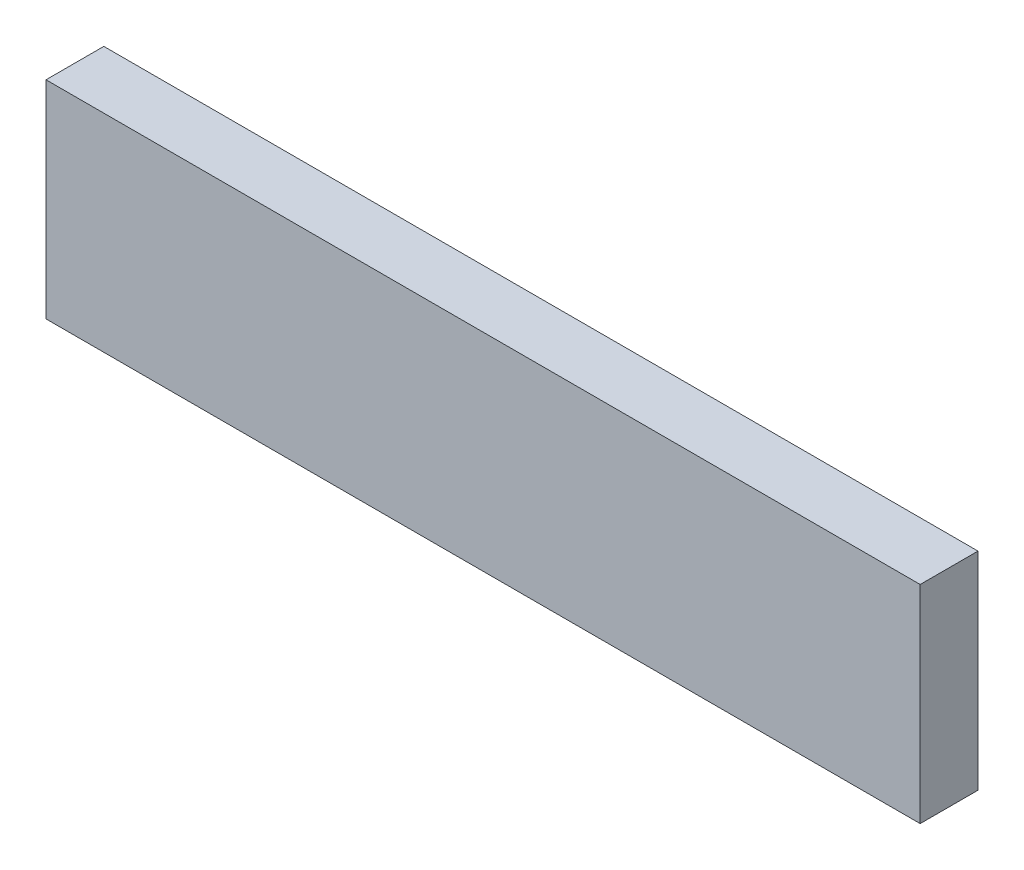
from build123d import *

# Parameters (mm, degrees)
SKETCH1_W           = 95.98
SKETCH1_H           = 22.74
BOSS_EXTRUDE1_DEPTH = 6.35


with BuildPart() as part:
    # Sketch1 → Boss-Extrude1 (new body)
    with BuildSketch(Plane.XY):
        Rectangle(SKETCH1_W, SKETCH1_H)
    extrude(amount=BOSS_EXTRUDE1_DEPTH)


solid = part.part
